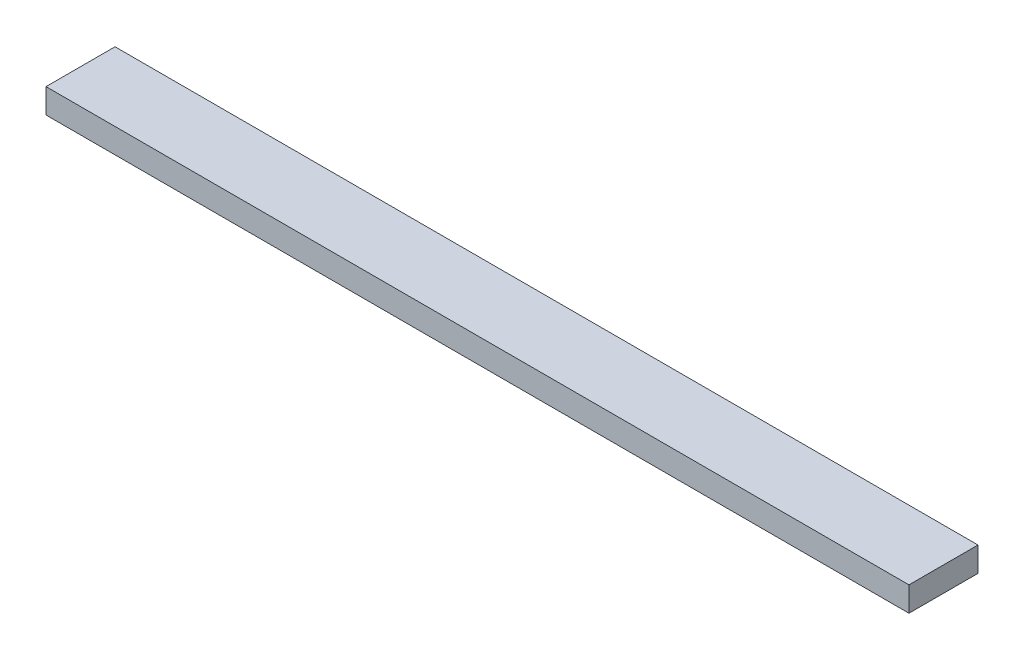
from build123d import *

# Parameters (mm, degrees)
SKETCH1_W           = 100
SKETCH1_H           = 8
BOSS_EXTRUDE1_DEPTH = 2.85


with BuildPart() as part:
    # Sketch1 → Boss-Extrude1 (new body)
    with BuildSketch(Plane(origin=(0, 0, 0), x_dir=(1, 0, 0), z_dir=(0, 1, 0))):
        Rectangle(SKETCH1_W, SKETCH1_H)
    extrude(amount=BOSS_EXTRUDE1_DEPTH)


solid = part.part
